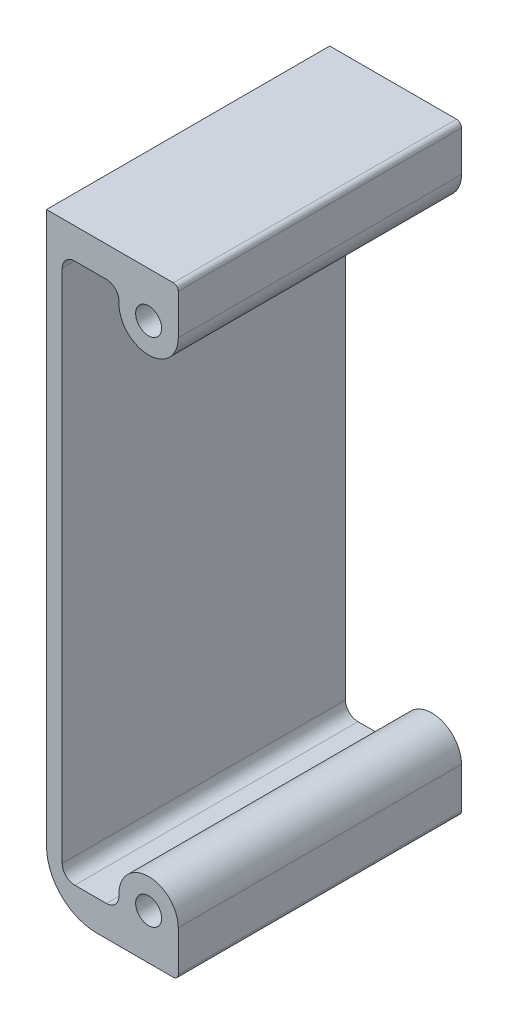
from build123d import *

# Parameters (mm, degrees)
SKETCH1_R           = 2.62509
SKETCH1_R_2         = 2.6289
BOSS_EXTRUDE1_DEPTH = 57.3024
FILLET1_R           = 2.54
FILLET2_R           = 1
FILLET3_R           = 10.16


with BuildPart() as part:
    # Sketch1 → Boss-Extrude1 (new body)
    with BuildSketch(Plane.XY):
        with BuildLine():
            Line((26.744137004, -45.371617498), (26.744137004, -48.371357498))
            Line((26.744137004, -48.371357498), (15.258617004, -48.371357498))
            Line((15.258617004, -48.371357498), (15.258617004, 60.986122502))
            Line((15.258617004, 60.986122502), (26.744137004, 60.986122502))
            Line((26.744137004, 60.986122502), (26.744137004, 57.986382502))
            ThreePointArc((26.744137004, 57.986382502), (32.743617004, 51.986902502), (38.743097004, 57.986382502))
            Line((38.743097004, 57.986382502), (38.743097004, 67.160862502))
            Line((38.743097004, 67.160862502), (32.743617004, 67.160862502))
            Line((32.743617004, 67.160862502), (12.083617004, 67.160862502))
            Line((12.083617004, 67.160862502), (12.083617004, -54.546097498))
            Line((12.083617004, -54.546097498), (32.743617004, -54.546097498))
            Line((32.743617004, -54.546097498), (38.743097004, -54.546097498))
            Line((38.743097004, -54.546097498), (38.743097004, -45.371617498))
            ThreePointArc((38.743097004, -45.371617498), (32.743617004, -39.372137498), (26.744137004, -45.371617498))
        make_face()
        with Locations((32.743617004, -45.371617498)):
            Circle(SKETCH1_R, mode=Mode.SUBTRACT)
        with Locations((32.743617004, 57.986382502)):
            Circle(SKETCH1_R_2, mode=Mode.SUBTRACT)
    extrude(amount=BOSS_EXTRUDE1_DEPTH)

    # Fillet1
    fillet1_edges = [part.edges().sort_by_distance(p)[0] for p in [
        (26.744137004, 60.986122502, 28.6512),
        (15.258617004, 60.986122502, 28.6512),
        (15.258617004, -48.371357498, 28.6512),
        (26.744137004, -48.371357498, 28.6512),
    ]]
    fillet(fillet1_edges, radius=FILLET1_R)

    # Fillet2
    fillet2_edges = [part.edges().sort_by_distance(p)[0] for p in [
        (38.743097004, -54.546097498, 28.6512),
        (38.743097004, 67.160862502, 28.6512),
    ]]
    fillet(fillet2_edges, radius=FILLET2_R)

    # Fillet3
    fillet3_edges = [part.edges().sort_by_distance(p)[0] for p in [
        (12.083617004, -54.546097498, 28.6512),
    ]]
    fillet(fillet3_edges, radius=FILLET3_R)


solid = part.part
